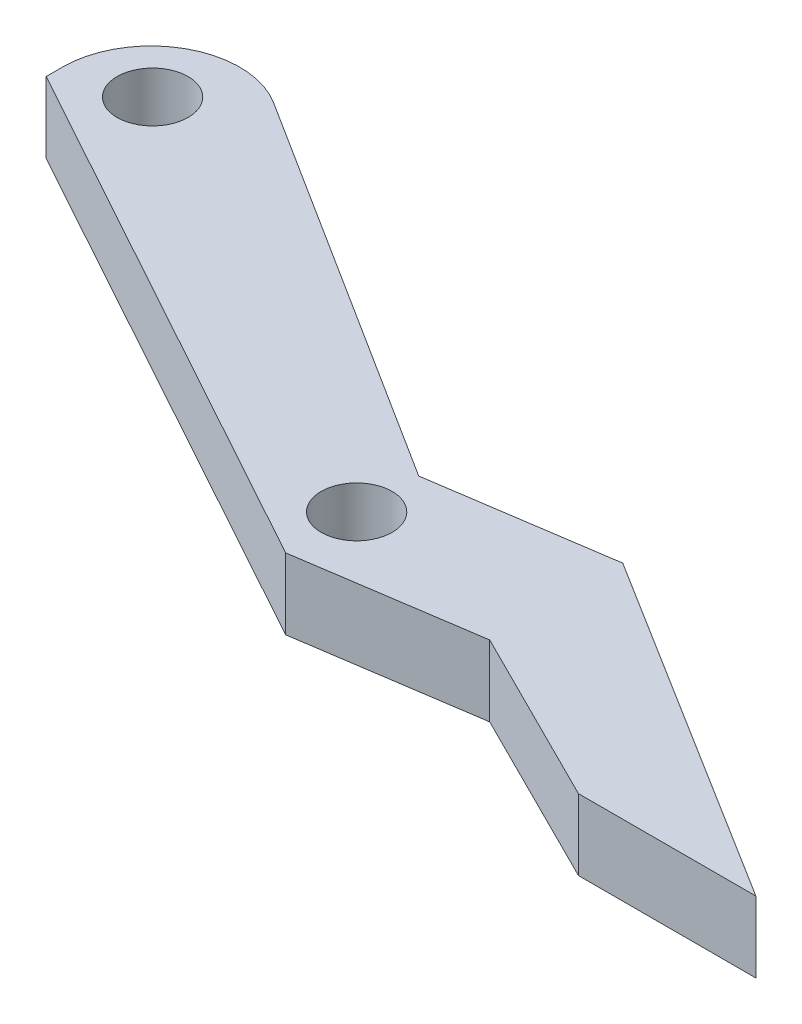
from build123d import *

# Parameters (mm, degrees)
SKETCH1_R           = 4
BOSS_EXTRUDE1_DEPTH = 8
FILLET1_R           = 10


with BuildPart() as part:
    # Sketch1 → Boss-Extrude1 (new body)
    with BuildSketch(Plane(origin=(0, 0, 0), x_dir=(1, 0, 0), z_dir=(0, 1, 0))):
        Polygon((120, 0), (100, 0), (80, 10), (60, 7), (0, 40), (0, 60), (60, 22), (80, 25), align=None)
        with Locations(Location((60, 15, 0), (0, 0, 270))):
            Circle(SKETCH1_R, mode=Mode.SUBTRACT)
        with Locations(Location((8, 44, 0), (0, 0, 270))):
            Circle(SKETCH1_R, mode=Mode.SUBTRACT)
    extrude(amount=BOSS_EXTRUDE1_DEPTH)

    # Fillet1
    fillet1_edges = [part.edges().sort_by_distance(p)[0] for p in [
        (0, 4, -60),
    ]]
    fillet(fillet1_edges, radius=FILLET1_R)


solid = part.part
